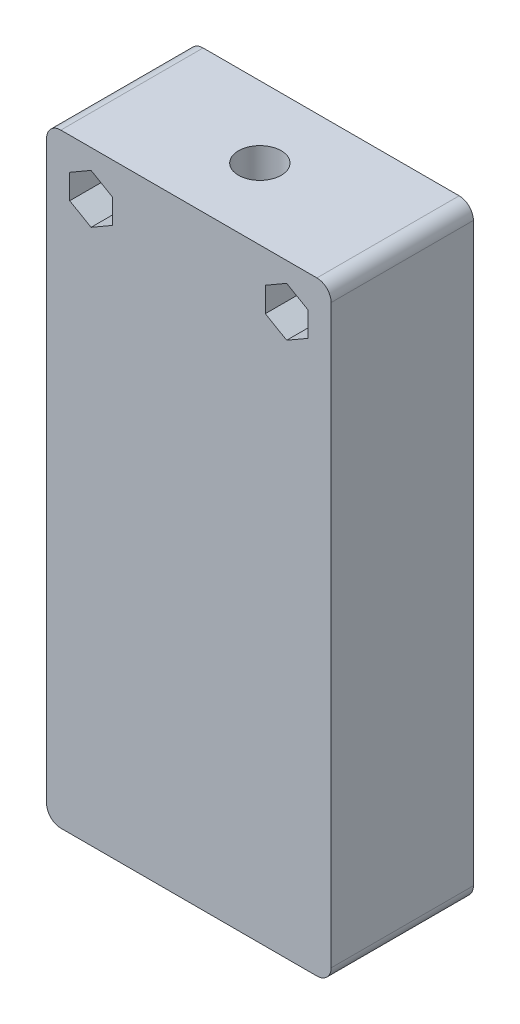
from build123d import *

# Parameters (mm, degrees)
SKETCH_1_W           = 40
SKETCH_1_H           = 85
EXTRUDE_1_DEPTH      = 20
SKETCH_2_W           = 30
SKETCH_2_H           = 60
CUT_EXTRUDE_1_DEPTH  = 15
SKETCH_3_W           = 31.5
SKETCH_3_H           = 16
CUT_EXTRUDE_3_DEPTH  = 7
SKETCH_4_R           = 1.5
CUT_EXTRUDE_4_DEPTH  = 16
FILLET_1_R           = 2
FILLET_2_R           = 2
SKETCH_6_W           = 15.3
SKETCH_6_H           = 12
CUT_EXTRUDE_5_DEPTH  = 4
SKETCH_7_W           = 3
SKETCH_7_H           = 52
EXTRUDE_2_DEPTH      = 10
SKETCH_8_W           = 17
SKETCH_8_H           = 1.5
CUT_EXTRUDE_6_DEPTH  = 2
CHAMFER_1_SIZE       = 0.7
SKETCH_9_R           = 3
CUT_EXTRUDE_7_DEPTH  = 15
SKETCH_10_W          = 3
SKETCH_10_H          = 3
CUT_EXTRUDE_8_DEPTH  = 2.5
EXTRUDE_START        = -15
SKETCH_14_R          = 6.25
EXTRUDE_4_DEPTH      = 10
CUT_EXTRUDE_START    = -5
SKETCH_16_R          = 5
CUT_EXTRUDE_10_DEPTH = 5
SKETCH_17_R          = 1.8
CUT_EXTRUDE_11_DEPTH = 96.131487952
CUT_EXTRUDE_12_DEPTH = 12


with BuildPart() as part:
    # Эскиз1 → Бобышка-Вытянуть1 (new body)
    with BuildSketch(Plane.XY):
        with Locations((-20, -42.5)):
            Rectangle(SKETCH_1_W, SKETCH_1_H)
    extrude(amount=EXTRUDE_1_DEPTH)

    # Эскиз2 → Вырез-Вытянуть1 (cut)
    with BuildSketch(Plane(origin=(0, 0, 0), x_dir=(-1, 0, 0), z_dir=(0, 0, -1))):
        with Locations((20, -36)):
            Rectangle(SKETCH_2_W, SKETCH_2_H)
    extrude(amount=-CUT_EXTRUDE_1_DEPTH, mode=Mode.SUBTRACT)

    # Эскиз3 → Вырез-Вытянуть3 (cut)
    with BuildSketch(Plane.XZ.offset(85)):
        with Locations((-20, 8)):
            Rectangle(SKETCH_3_W, SKETCH_3_H)
    extrude(amount=-CUT_EXTRUDE_3_DEPTH, mode=Mode.SUBTRACT)

    # Эскиз4 → Вырез-Вытянуть4 (cut)
    with BuildSketch(Plane.XZ.offset(78)):
        with Locations(Location((-7.5, 9.636214897, 0), (0, 0, 270))):
            Circle(SKETCH_4_R)
        with Locations(Location((-32.5, 9.636214897, 0), (0, 0, 270))):
            Circle(SKETCH_4_R)
        with BuildLine():
            Line((-13.531390771, 15.3), (-26.468609229, 15.3))
            ThreePointArc((-26.468609229, 15.3), (-28.268414536, 14.644924441), (-29.226070938, 12.986214897))
            Line((-29.226070938, 12.986214897), (-30.407461708, 6.286214897))
            ThreePointArc((-30.407461708, 6.286214897), (-29.794924441, 4.000194693), (-27.65, 3))
            Line((-27.65, 3), (-12.35, 3))
            ThreePointArc((-12.35, 3), (-10.205075559, 4.000194693), (-9.592538292, 6.286214897))
            Line((-9.592538292, 6.286214897), (-10.773929062, 12.986214897))
            ThreePointArc((-10.773929062, 12.986214897), (-11.731585464, 14.644924441), (-13.531390771, 15.3))
        make_face()
    extrude(amount=-CUT_EXTRUDE_4_DEPTH, mode=Mode.SUBTRACT)

    # Скругление1
    fillet_1_edges = [part.edges().sort_by_distance(p)[0] for p in [
        (-4.25, -81.5, 16),
        (-35.75, -81.5, 16),
    ]]
    fillet(fillet_1_edges, radius=FILLET_1_R)

    # Скругление2
    fillet_2_edges = [part.edges().sort_by_distance(p)[0] for p in [
        (0, -85, 10),
        (-40, -85, 10),
        (-40, 0, 10),
        (0, 0, 10),
    ]]
    fillet(fillet_2_edges, radius=FILLET_2_R)

    # Эскиз6 → Вырез-Вытянуть5 (cut)
    with BuildSketch(Plane(origin=(0, 0, 0), x_dir=(-1, 0, 0), z_dir=(0, 0, -1))):
        with Locations((20, -72)):
            Rectangle(SKETCH_6_W, SKETCH_6_H)
    extrude(amount=-CUT_EXTRUDE_5_DEPTH, mode=Mode.SUBTRACT)

    # Эскиз7 → Бобышка-Вытянуть2 (add)
    with BuildSketch(Plane(origin=(0, 0, 15), x_dir=(-1, 0, 0), z_dir=(0, 0, -1))):
        with Locations((10.1, -32)):
            Rectangle(SKETCH_7_W, SKETCH_7_H)
        with Locations((27.1, -32)):
            Rectangle(SKETCH_7_W, SKETCH_7_H)
    extrude(amount=EXTRUDE_2_DEPTH)

    # Эскиз8 → Вырез-Вытянуть6 (cut)
    with BuildSketch(Plane.XZ.offset(6)):
        with Locations((-18.6, 4.25)):
            Rectangle(SKETCH_8_W, SKETCH_8_H)
    extrude(amount=-CUT_EXTRUDE_6_DEPTH, mode=Mode.SUBTRACT)

    # Фаска1
    chamfer_1_edges = [part.edges().sort_by_distance(p)[0] for p in [
        (-18.6, -4, 3.5),
    ]]
    chamfer(chamfer_1_edges, length=CHAMFER_1_SIZE)

    # Эскиз9 → Вырез-Вытянуть7 (cut)
    with BuildSketch(Plane.XZ.offset(6)):
        with Locations(Location((-20, 10.022807371, 0), (0, 0, 270))):
            Circle(SKETCH_9_R)
    extrude(amount=-CUT_EXTRUDE_7_DEPTH, mode=Mode.SUBTRACT)

    # Эскиз10 → Вырез-Вытянуть8 (cut)
    with BuildSketch(Plane(origin=(0, -66, 0), x_dir=(1, 0, 0), z_dir=(0, 1, 0))):
        with Locations((-33.5, -3.5)):
            Rectangle(SKETCH_10_W, SKETCH_10_H)
        with Locations((-6.5, -3.5)):
            Rectangle(SKETCH_10_W, SKETCH_10_H)
    extrude(amount=-CUT_EXTRUDE_8_DEPTH, mode=Mode.SUBTRACT)

    # Эскиз14 → Бобышка-Вытянуть4 (add)
    with BuildSketch(Plane(origin=(0, 0, 0), x_dir=(-1, 0, 0), z_dir=(0, 0, -1)).offset(EXTRUDE_START)):
        with Locations((6.25, -6.25)):
            Circle(SKETCH_14_R)
        with Locations((33.75, -6.25)):
            Circle(SKETCH_14_R)
    extrude(amount=EXTRUDE_4_DEPTH)

    # Эскиз16 → Вырез-Вытянуть10 (cut)
    with BuildSketch(Plane(origin=(0, 0, 0), x_dir=(-1, 0, 0), z_dir=(0, 0, -1)).offset(CUT_EXTRUDE_START)):
        with Locations((6.25, -6.25)):
            Circle(SKETCH_16_R)
        with Locations((33.75, -6.25)):
            Circle(SKETCH_16_R)
    extrude(amount=CUT_EXTRUDE_10_DEPTH, mode=Mode.SUBTRACT)

    # Эскиз17 → Вырез-Вытянуть11 (cut, through all)
    with BuildSketch(Plane(origin=(0, 0, 5), x_dir=(-1, 0, 0), z_dir=(0, 0, -1))):
        with Locations((6.25, -6.25)):
            Circle(SKETCH_17_R)
        with Locations((33.75, -6.25)):
            Circle(SKETCH_17_R)
    extrude(amount=-CUT_EXTRUDE_11_DEPTH, mode=Mode.SUBTRACT)

    # Эскиз18 → Вырез-Вытянуть12 (cut)
    with BuildSketch(Plane.XY.offset(20)):
        Polygon((-6.25, -9.714101615), (-3.25, -7.982050808), (-3.25, -4.517949192), (-6.25, -2.785898385), (-9.25, -4.517949192), (-9.25, -7.982050808), align=None)
        Polygon((-30.75, -4.517949192), (-33.75, -2.785898385), (-36.75, -4.517949192), (-36.75, -7.982050808), (-33.75, -9.714101615), (-30.75, -7.982050808), align=None)
    extrude(amount=-CUT_EXTRUDE_12_DEPTH, mode=Mode.SUBTRACT)


solid = part.part
